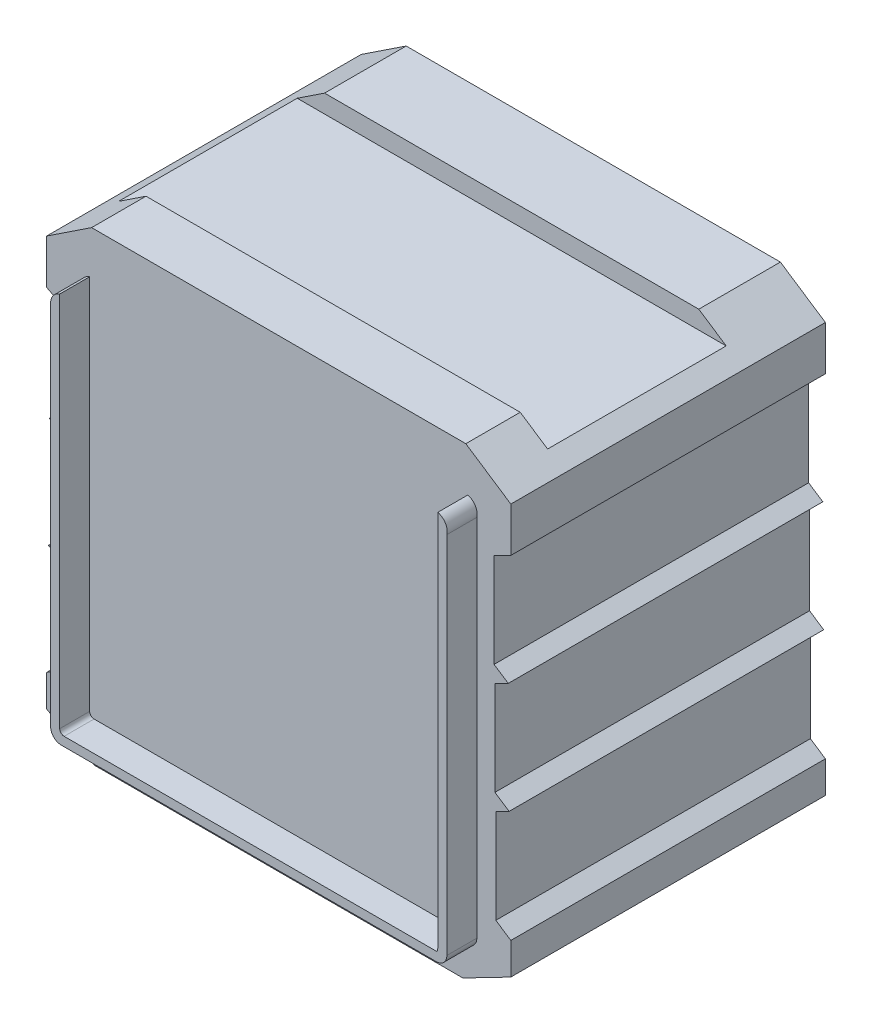
from build123d import *

# Parameters (mm, degrees)
BOSS_EXTRUDE1_DEPTH = 173.478
BOSS_EXTRUDE2_DEPTH = 16.522
SKETCH5_W           = 256
SKETCH5_H           = 98.478
CUT_EXTRUDE3_DEPTH  = 10


with BuildPart() as part:
    # Sketch1 → Boss-Extrude1 (new body)
    with BuildSketch(Plane.XY):
        Polygon((-103.1895488, 0), (103.1895488, 0), (128, -16.432610434), (128, -40.962966098), (118.774155672, -45.61934731), (118.774155672, -97.61934731), (126.583328469, -102.791566604), (119.25400561, -106.490753372), (119.25400561, -158.490753372), (127.063178407, -163.662972666), (119.733855548, -167.362159434), (119.733855548, -219.362159434), (128, -224.837043001), (128, -242.345271931), (101.558790198, -256), (-101.558790198, -256), (-128, -242.345271931), (-128, -224.837043001), (-119.733855548, -219.362159434), (-119.733855548, -167.362159434), (-127.063178407, -163.662972666), (-119.25400561, -158.490753372), (-119.25400561, -106.490753372), (-126.583328469, -102.791566604), (-118.774155672, -97.61934731), (-118.774155672, -45.61934731), (-128, -40.962966098), (-128, -16.432610434), align=None)
    extrude(amount=BOSS_EXTRUDE1_DEPTH)

    # Sketch3 → Boss-Extrude2 (add)
    with BuildSketch(Plane.XY.offset(173.478)):
        with BuildLine():
            Line((-109.25400561, -30.77642723), (-109.25400561, -233.134965715))
            ThreePointArc((-109.25400561, -233.134965715), (-107.53617684, -237.28217123), (-103.388971325, -239))
            Line((-103.388971325, -239), (103.388971325, -239))
            ThreePointArc((103.388971325, -239), (107.53617684, -237.28217123), (109.25400561, -233.134965715))
            Line((109.25400561, -233.134965715), (109.25400561, -32.174007784))
            ThreePointArc((109.25400561, -32.174007784), (108.447882002, -27.049094521), (104.25400561, -23.99524907))
            Line((104.25400561, -23.99524907), (104.25400561, -231.784495248))
            ThreePointArc((104.25400561, -231.784495248), (104.136715259, -232.916299233), (103.789829206, -234))
            Line((103.789829206, -234), (-101.829987525, -234))
            ThreePointArc((-101.829987525, -234), (-103.544027151, -233.290021541), (-104.25400561, -231.575981915))
            Line((-104.25400561, -231.575981915), (-104.25400561, -23.99524907))
            ThreePointArc((-104.25400561, -23.99524907), (-107.868861491, -26.563815889), (-109.25400561, -30.77642723))
        make_face()
    extrude(amount=BOSS_EXTRUDE2_DEPTH)

    # Sketch5 → Cut-Extrude3 (cut)
    with BuildSketch(Plane(origin=(0, 0, 0), x_dir=(1, 0, 0), z_dir=(0, 1, 0))):
        with Locations((0, -94.239)):
            Rectangle(SKETCH5_W, SKETCH5_H)
    extrude(amount=-CUT_EXTRUDE3_DEPTH, mode=Mode.SUBTRACT)


solid = part.part
